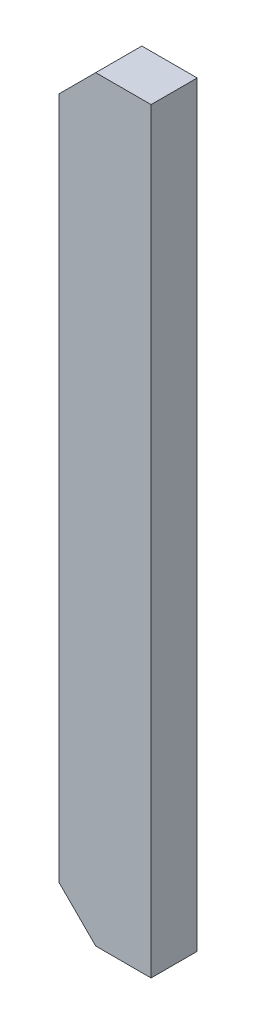
from build123d import *

# Parameters (mm, degrees)
EXTRUDE_1_DEPTH = 10


with BuildPart() as part:
    # 草图1 → 凸台-拉伸1 (new body)
    with BuildSketch(Plane.XY):
        Polygon((0, 0), (-12, 0), (-20, -8), (-20, -156), (-12, -164), (0, -164), align=None)
    extrude(amount=EXTRUDE_1_DEPTH)


solid = part.part
